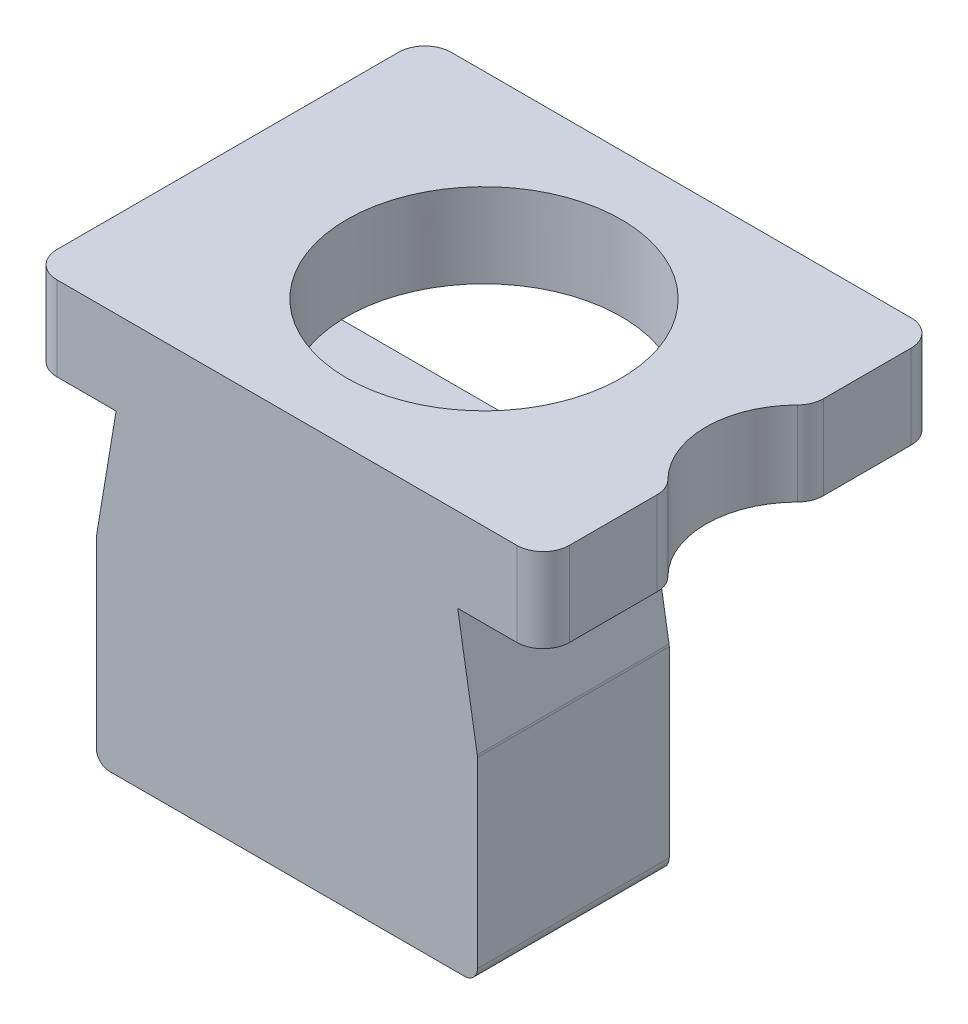
from build123d import *

# Parameters (mm, degrees)
SKETCH1_W           = 39
SKETCH1_H           = 30
SKETCH1_R           = 10.45
BOSS_EXTRUDE1_DEPTH = 6.4
BOSS_EXTRUDE2_DEPTH = 14.6
CUT_EXTRUDE1_DEPTH  = 6.4
FILLET1_R           = 2
FILLET2_R           = 1


with BuildPart() as part:
    # Sketch1 → Boss-Extrude1 (new body)
    with BuildSketch(Plane(origin=(0, 0, 0), x_dir=(1, 0, 0), z_dir=(0, 1, 0))):
        Rectangle(SKETCH1_W, SKETCH1_H)
        with Locations(Location((0, 0, 0), (0, 0, 270))):
            Circle(SKETCH1_R, mode=Mode.SUBTRACT)
    extrude(amount=BOSS_EXTRUDE1_DEPTH)

    # Sketch2 → Boss-Extrude2 (add)
    with BuildSketch(Plane.XY.offset(15)):
        Polygon((-13, 0), (-14.5, -9), (-14.5, -24), (14.5, -24), (14.5, -9), (13, 0), align=None)
    extrude(amount=-BOSS_EXTRUDE2_DEPTH)

    # Sketch3 → Cut-Extrude1 (cut)
    with BuildSketch(Plane(origin=(0, 6.4, 0), x_dir=(1, 0, 0), z_dir=(0, 1, 0))):
        with BuildLine():
            Line((19.5, 5.45), (19.5, -5.45))
            ThreePointArc((19.5, -5.45), (16.892891986, 0), (19.5, 5.45))
        make_face()
    extrude(amount=-CUT_EXTRUDE1_DEPTH, mode=Mode.SUBTRACT)

    # Fillet1
    fillet1_edges = [part.edges().sort_by_distance(p)[0] for p in [
        (19.5, 3.2, -5.45),
        (19.5, 3.2, 5.45),
        (19.5, 3.2, 15),
        (-19.5, 3.2, 15),
        (-19.5, 3.2, -15),
        (19.5, 3.2, -15),
    ]]
    fillet(fillet1_edges, radius=FILLET1_R)

    # Fillet2
    fillet2_edges = [part.edges().sort_by_distance(p)[0] for p in [
        (14.5, -9, 7.7),
        (14.5, -24, 7.7),
        (-14.5, -24, 7.7),
        (-14.5, -9, 7.7),
    ]]
    fillet(fillet2_edges, radius=FILLET2_R)


solid = part.part
